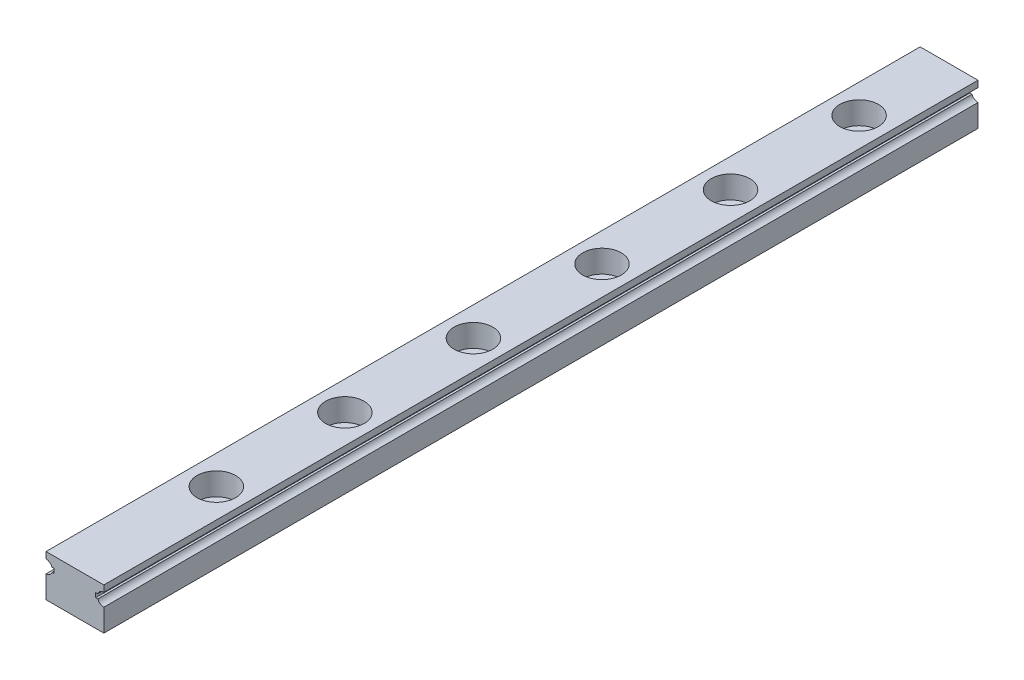
from build123d import *

# Parameters (mm, degrees)
EXTRUDE1_DEPTH  = 136
SKETCH2_R       = 3
EXTRUDE2_DEPTH  = 3.5
SKETCH_R        = 1.75
EXTRUDE3_DEPTH  = 137.229585627
LPATTERN1_COUNT = 6
LPATTERN1_PITCH = 20


with BuildPart() as part:
    # Sketch1 → Extrude1 (new body)
    with BuildSketch(Plane.XY):
        with BuildLine():
            Line((-4.5, -3.25), (4.5, -3.25))
            Line((4.5, -3.25), (4.5, 0.25))
            ThreePointArc((4.5, 0.25), (3.93077967, 0.427814974), (3.563991137, 0.898023568))
            Line((3.563991137, 0.898023568), (3.235073025, 0.898023568))
            Line((3.235073025, 0.898023568), (3.235073025, 1.601976432))
            Line((3.235073025, 1.601976432), (3.563991137, 1.601976432))
            ThreePointArc((3.563991137, 1.601976432), (3.93077967, 2.072185026), (4.5, 2.25))
            Line((4.5, 2.25), (4.5, 3.25))
            Line((4.5, 3.25), (-4.5, 3.25))
            Line((-4.5, 3.25), (-4.5, 2.25))
            ThreePointArc((-4.5, 2.25), (-3.93077967, 2.072185026), (-3.563991137, 1.601976432))
            Line((-3.563991137, 1.601976432), (-3.235073025, 1.601976432))
            Line((-3.235073025, 1.601976432), (-3.235073025, 0.898023568))
            Line((-3.235073025, 0.898023568), (-3.563991137, 0.898023568))
            ThreePointArc((-3.563991137, 0.898023568), (-3.93077967, 0.427814974), (-4.5, 0.25))
            Line((-4.5, 0.25), (-4.5, -3.25))
        make_face()
    extrude(amount=EXTRUDE1_DEPTH)

    # Sketch2 → Extrude2 (cut)
    with BuildSketch(Plane(origin=(0, 3.25, 0), x_dir=(1, 0, 0), z_dir=(0, 1, 0))):
        with Locations((0, -14)):
            Circle(SKETCH2_R)
    extrude2 = extrude(amount=-EXTRUDE2_DEPTH, mode=Mode.SUBTRACT)

    # Sketch → Extrude3 (cut, through all)
    with BuildSketch(Plane(origin=(0, 3.25, 0), x_dir=(1, 0, 0), z_dir=(0, 1, 0))):
        with Locations((0, -14)):
            Circle(SKETCH_R)
    extrude3 = extrude(amount=-EXTRUDE3_DEPTH, mode=Mode.SUBTRACT)

    # LPattern1: Extrude2, Extrude3 ×6
    with Locations(*[(0, 0, i * LPATTERN1_PITCH) for i in range(1, LPATTERN1_COUNT)]):
        add(extrude2, mode=Mode.SUBTRACT)
        add(extrude3, mode=Mode.SUBTRACT)


solid = part.part
